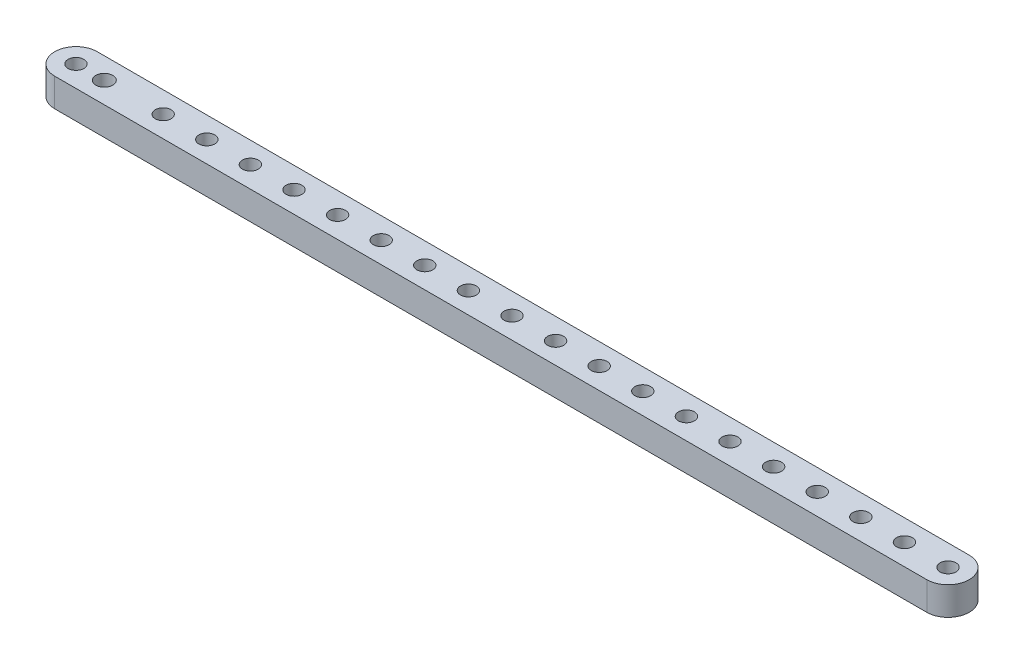
from build123d import *

# Parameters (mm, degrees)
SKETCH1_R           = 1.778
BOSS_EXTRUDE1_DEPTH = 6.35
SKETCH2_R           = 1.778
BOSS_EXTRUDE2_DEPTH = 6.35
SKETCH3_R           = 1.905
CUT_EXTRUDE1_DEPTH  = 103.859220114


with BuildPart() as part:
    # Sketch1 → Boss-Extrude1 (new body)
    with BuildSketch(Plane(origin=(0, 6.35, 0), x_dir=(1, 0, 0), z_dir=(0, 1, 0))):
        with BuildLine():
            Line((97.79, 4.7625), (-97.79, 4.7625))
            ThreePointArc((-97.79, 4.7625), (-102.5525, 0), (-97.79, -4.7625))
            Line((-97.79, -4.7625), (97.79, -4.7625))
            ThreePointArc((97.79, -4.7625), (102.5525, 0), (97.79, 4.7625))
        make_face()
        with Locations(Location((97.79, 0, 0), (0, 0, 90))):
            Circle(SKETCH1_R, mode=Mode.SUBTRACT)
        with Locations(Location((88.011, 0, 0), (0, 0, 90))):
            Circle(SKETCH1_R, mode=Mode.SUBTRACT)
        with Locations(Location((78.232, 0, 0), (0, 0, 90))):
            Circle(SKETCH1_R, mode=Mode.SUBTRACT)
        with Locations(Location((68.453, 0, 0), (0, 0, 90))):
            Circle(SKETCH1_R, mode=Mode.SUBTRACT)
        with Locations(Location((58.674, 0, 0), (0, 0, 90))):
            Circle(SKETCH1_R, mode=Mode.SUBTRACT)
        with Locations(Location((48.895, 0, 0), (0, 0, 90))):
            Circle(SKETCH1_R, mode=Mode.SUBTRACT)
        with Locations(Location((39.116, 0, 0), (0, 0, 90))):
            Circle(SKETCH1_R, mode=Mode.SUBTRACT)
        with Locations(Location((29.337, 0, 0), (0, 0, 90))):
            Circle(SKETCH1_R, mode=Mode.SUBTRACT)
        with Locations(Location((19.558, 0, 0), (0, 0, 90))):
            Circle(SKETCH1_R, mode=Mode.SUBTRACT)
        with Locations(Location((9.779, 0, 0), (0, 0, 90))):
            Circle(SKETCH1_R, mode=Mode.SUBTRACT)
        with Locations(Location((0, 0, 0), (0, 0, 90))):
            Circle(SKETCH1_R, mode=Mode.SUBTRACT)
        with Locations(Location((-9.779, 0, 0), (0, 0, 90))):
            Circle(SKETCH1_R, mode=Mode.SUBTRACT)
        with Locations(Location((-19.558, 0, 0), (0, 0, 90))):
            Circle(SKETCH1_R, mode=Mode.SUBTRACT)
        with Locations(Location((-29.337, 0, 0), (0, 0, 90))):
            Circle(SKETCH1_R, mode=Mode.SUBTRACT)
        with Locations(Location((-39.116, 0, 0), (0, 0, 90))):
            Circle(SKETCH1_R, mode=Mode.SUBTRACT)
        with Locations(Location((-48.895, 0, 0), (0, 0, 90))):
            Circle(SKETCH1_R, mode=Mode.SUBTRACT)
        with Locations(Location((-58.674, 0, 0), (0, 0, 90))):
            Circle(SKETCH1_R, mode=Mode.SUBTRACT)
        with Locations(Location((-68.453, 0, 0), (0, 0, 90))):
            Circle(SKETCH1_R, mode=Mode.SUBTRACT)
        with Locations(Location((-78.232, 0, 0), (0, 0, 90))):
            Circle(SKETCH1_R, mode=Mode.SUBTRACT)
        with Locations(Location((-88.011, 0, 0), (0, 0, 90))):
            Circle(SKETCH1_R, mode=Mode.SUBTRACT)
        with Locations(Location((-97.79, 0, 0), (0, 0, 90))):
            Circle(SKETCH1_R, mode=Mode.SUBTRACT)
    extrude(amount=-BOSS_EXTRUDE1_DEPTH)

    # Sketch2 → Boss-Extrude2 (add)
    with BuildSketch(Plane(origin=(0, 6.35, 0), x_dir=(1, 0, 0), z_dir=(0, 1, 0))):
        with Locations((-88.011, 0)):
            Circle(SKETCH2_R)
    extrude(amount=-BOSS_EXTRUDE2_DEPTH)

    # Sketch3 → Cut-Extrude1 (cut, through all)
    with BuildSketch(Plane(origin=(0, 6.35, 0), x_dir=(1, 0, 0), z_dir=(0, 1, 0))):
        with Locations(Location((-91.44, 0, 0), (0, 0, 270))):
            Circle(SKETCH3_R)
    extrude(amount=-CUT_EXTRUDE1_DEPTH, mode=Mode.SUBTRACT)


solid = part.part
